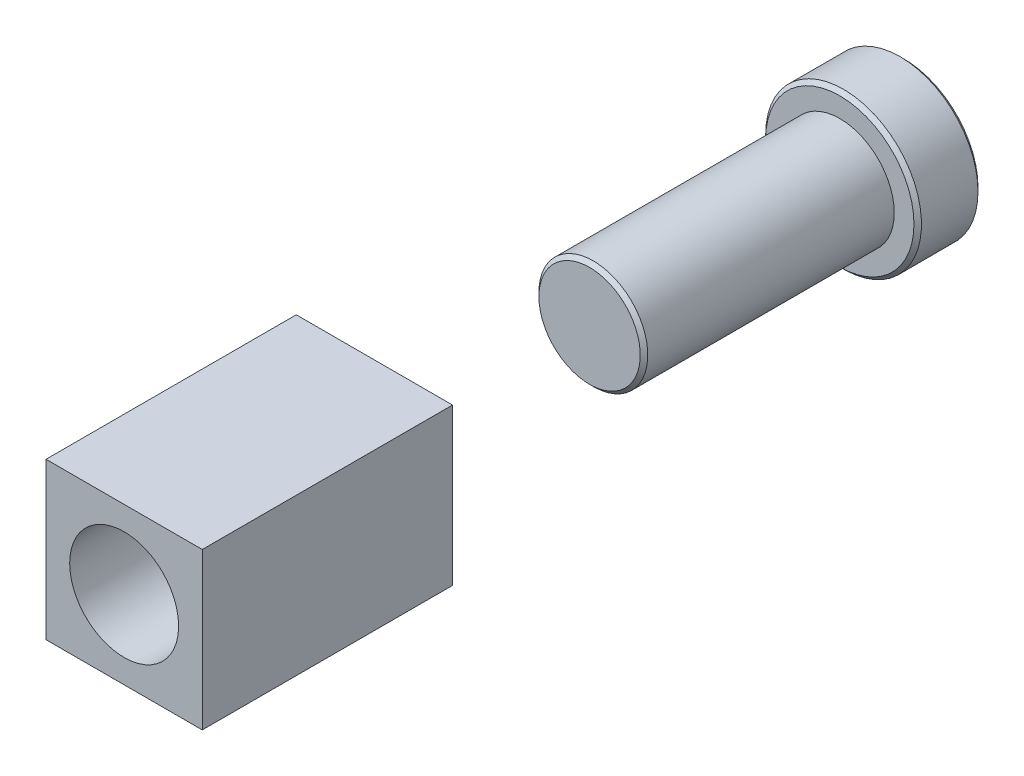
from build123d import *

# Parameters (mm, degrees)
SKETCH1_R           = 15.8115
BOSS_EXTRUDE1_DEPTH = 12.998823529
SKETCH2_R           = 11.049
BOSS_EXTRUDE2_DEPTH = 50.8
SKETCH3_W           = 31.722698392
SKETCH3_H           = 31.722698392
BOSS_EXTRUDE3_DEPTH = 50.8
SKETCH4_R           = 11.05535
CUT_EXTRUDE1_DEPTH  = 110.798996017
CHAMFER1_SIZE       = 0.762


with BuildPart() as part:
    # Sketch1 → Boss-Extrude1 (new body)
    with BuildSketch(Plane.XY):
        with Locations(Location((0, 0, 0), (0, 0, 180))):
            Circle(SKETCH1_R)
    extrude(amount=BOSS_EXTRUDE1_DEPTH)

    # Sketch2 → Boss-Extrude2 (add)
    with BuildSketch(Plane.XY.offset(12.998823529)):
        Circle(SKETCH2_R)
    extrude(amount=BOSS_EXTRUDE2_DEPTH)

    # Chamfer1
    chamfer1_edges = [part.edges().sort_by_distance(p)[0] for p in [
        (15.8115, 0, 0),
        (15.8115, 0, 12.998823529),
        (-11.049, 0, 63.798823529),
    ]]
    chamfer(chamfer1_edges, length=CHAMFER1_SIZE)


with BuildPart() as body_2:
    # Sketch3 → Boss-Extrude3 (new body)
    with BuildSketch(Plane.XY.offset(107.483276511)):
        Rectangle(SKETCH3_W, SKETCH3_H)
    extrude(amount=BOSS_EXTRUDE3_DEPTH)

    # Sketch4 → Cut-Extrude1 (cut, through all)
    with BuildSketch(Plane(origin=(0, 0, 107.483276511), x_dir=(-1, 0, 0), z_dir=(0, 0, -1))):
        Circle(SKETCH4_R)
    extrude(amount=-CUT_EXTRUDE1_DEPTH, mode=Mode.SUBTRACT)


solid = Compound([part.part, body_2.part])
